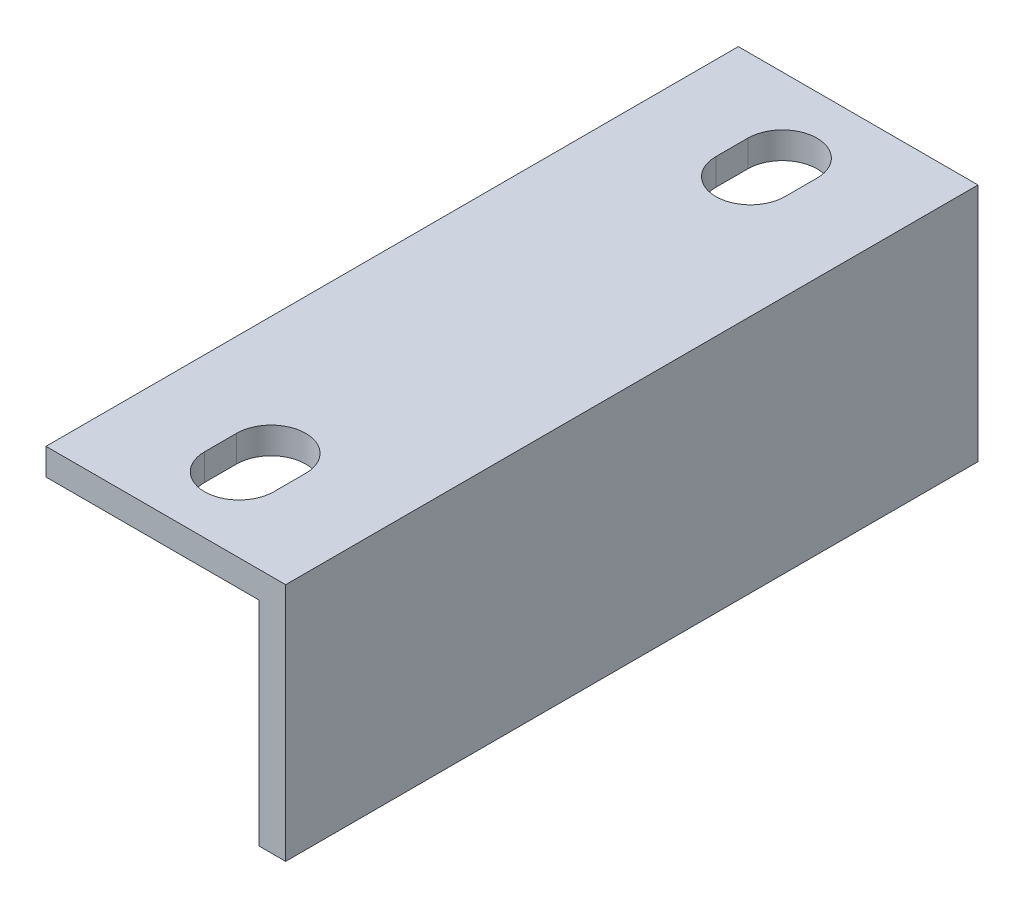
from build123d import *

# Parameters (mm, degrees)
BOSS_EXTRUDE1_DEPTH = 130
CUT_EXTRUDE1_DEPTH  = 10


with BuildPart() as part:
    # Sketch2 → Boss-Extrude1 (new body)
    with BuildSketch(Plane.XY):
        Polygon((0, 0), (40, 0), (40, -40), (45, -40), (45, 5), (0, 5), align=None)
    extrude(amount=BOSS_EXTRUDE1_DEPTH)

    # Sketch3 → Cut-Extrude1 (cut)
    with BuildSketch(Plane(origin=(0, 5, 0), x_dir=(1, 0, 0), z_dir=(0, 1, 0))):
        with BuildLine():
            Line((28.773082799, -14), (28.773082799, -20))
            ThreePointArc((28.773082799, -20), (22.273082799, -26.5), (15.773082799, -20))
            Line((15.773082799, -20), (15.773082799, -14))
            ThreePointArc((15.773082799, -14), (22.273082799, -7.5), (28.773082799, -14))
        make_face()
        with BuildLine():
            Line((28.773082799, -116), (28.773082799, -110))
            ThreePointArc((28.773082799, -110), (22.273082799, -103.5), (15.773082799, -110))
            Line((15.773082799, -110), (15.773082799, -116))
            ThreePointArc((15.773082799, -116), (22.273082799, -122.5), (28.773082799, -116))
        make_face()
    extrude(amount=-CUT_EXTRUDE1_DEPTH, mode=Mode.SUBTRACT)


solid = part.part
